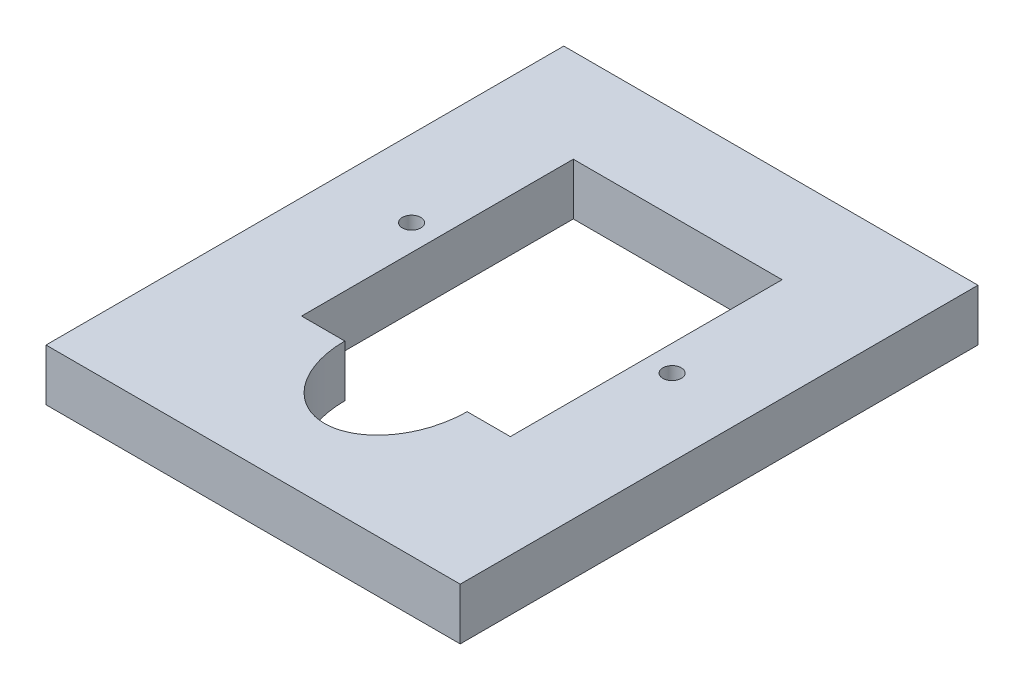
from build123d import *

# Parameters (mm, degrees)
SKETCH1_W           = 50.8
SKETCH1_H           = 63.5
SKETCH1_R           = 1.1303
BOSS_EXTRUDE1_DEPTH = 6.35


with BuildPart() as part:
    # Sketch1 → Boss-Extrude1 (new body)
    with BuildSketch(Plane(origin=(0, 0, 0), x_dir=(1, 0, 0), z_dir=(0, 1, 0))):
        with Locations((21.766538168, -1.869249963)):
            Rectangle(SKETCH1_W, SKETCH1_H)
        with Locations(Location((37.743138168, 1.788350037, 0), (0, 0, 270))):
            Circle(SKETCH1_R, mode=Mode.SUBTRACT)
        with Locations(Location((5.789938168, 1.788350037, 0), (0, 0, 270))):
            Circle(SKETCH1_R, mode=Mode.SUBTRACT)
        with BuildLine():
            Line((29.266538168, -14.874049963), (34.568138168, -14.874049963))
            Line((34.568138168, -14.874049963), (34.568138168, 18.450750037))
            Line((34.568138168, 18.450750037), (8.964938168, 18.450750037))
            Line((8.964938168, 18.450750037), (8.964938168, -14.874049963))
            Line((8.964938168, -14.874049963), (14.266538168, -14.874049963))
            add(Edge.make_bspline(
                [(14.266538168, -14.874049963), (14.266538168, -24.874049963), (21.766538168, -24.874049963), (29.266538168, -24.874049963), (29.266538168, -14.874049963)],
                knots=[1.570796327, 1.570796327, 1.570796327, 3.141592654, 3.141592654, 4.71238898, 4.71238898, 4.71238898], degree=2, weights=[1, 0.707106781, 1, 0.707106781, 1]))
        make_face(mode=Mode.SUBTRACT)
    extrude(amount=BOSS_EXTRUDE1_DEPTH)


solid = part.part
